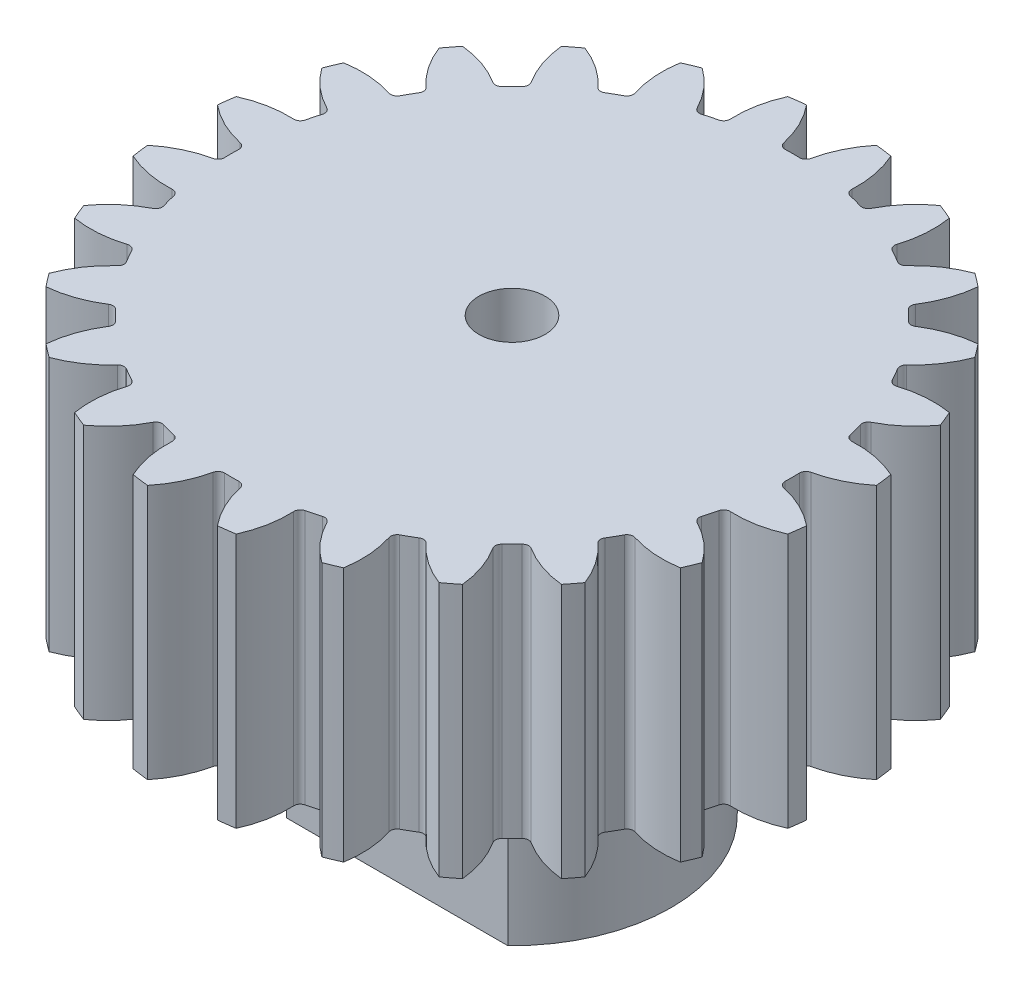
from build123d import *

# Parameters (mm, degrees)
SKETCH_1_R               = 26
EXTRUDE_1_DEPTH          = 20
SKETCH_2_R               = 12.5
EXTRUDE_2_DEPTH          = 14
CUT_EXTRUDE_1_REACH      = 43.857
PATTERN_CIRCULAR_1_COUNT = 24
CUT_EXTRUDE_4_DEPTH      = 42.676911108
CUT_EXTRUDE_4_DEPTH_BACK = 42.676911108
SKETCH_7_R               = 2.15
CUT_EXTRUDE_2_DEPTH      = 42.676911108
CUT_EXTRUDE_2_DEPTH_BACK = 42.676911108
SKETCH_5_R               = 2.6
CUT_EXTRUDE_START        = -12.5
SKETCH_8_W               = 25
SKETCH_8_H               = 14
CUT_EXTRUDE_5_DEPTH      = 3.5
CUT_EXTRUDE_START_2      = 12.5
SKETCH_8_2_W             = 25
SKETCH_8_2_H             = 14
CUT_EXTRUDE_6_DEPTH      = 3.5


with BuildPart() as part:
    # 草图1 → 凸台-拉伸1 (new body)
    with BuildSketch(Plane(origin=(0, 0, 0), x_dir=(1, 0, 0), z_dir=(0, 1, 0))):
        Circle(SKETCH_1_R)
    extrude(amount=EXTRUDE_1_DEPTH)

    # 草图2 → 凸台-拉伸2 (add)
    with BuildSketch(Plane(origin=(0, 0, 0), x_dir=(1, 0, 0), z_dir=(0, 1, 0))):
        Circle(SKETCH_2_R)
    extrude(amount=-EXTRUDE_2_DEPTH)

    # 草图4 → 切除-拉伸1 (cut, up to next)
    with BuildSketch(Plane(origin=(0, 0, 0), x_dir=(1, 0, 0), z_dir=(0, 1, 0)), mode=Mode.PRIVATE) as cut_extrude_1_sk1:
        with BuildLine():
            ThreePointArc((2.741813312, 25.855027746), (1.695394394, 24.220742425), (1.06187474, 22.386475838))
            ThreePointArc((1.06187474, 22.386475838), (0.882061796, 22.099428872), (0.560547841, 21.992857616))
            ThreePointArc((0.560547841, 21.992857616), (0, 22), (-0.560547841, 21.992857616))
            ThreePointArc((-0.560547841, 21.992857616), (-0.882061796, 22.099428872), (-1.06187474, 22.386475838))
            ThreePointArc((-1.06187474, 22.386475838), (-1.695394394, 24.220742425), (-2.741813312, 25.855027746))
            ThreePointArc((-2.741813312, 25.855027746), (0, 26), (2.741813312, 25.855027746))
        make_face()
    cut_extrude_1_tool1 = extrude(cut_extrude_1_sk1.sketch, amount=CUT_EXTRUDE_1_REACH, mode=Mode.PRIVATE) & part.part
    cut_extrude_1 = cut_extrude_1_tool1.solids().sort_by_distance((0, 0, -24.336645))[0]
    add(cut_extrude_1, mode=Mode.SUBTRACT)

    # 阵列(圆周)1: 切除-拉伸1 ×24 about axis
    pattern_circular_1_axis = Axis((0, 20, 0), (0, 1, 0))
    for i in range(1, PATTERN_CIRCULAR_1_COUNT):
        add(cut_extrude_1.rotate(pattern_circular_1_axis, i * 360 / PATTERN_CIRCULAR_1_COUNT), mode=Mode.SUBTRACT)

    # 草图7 → 切除-拉伸4 (cut, two sides: drawn at the far end of the back side and taken through both)
    with BuildSketch(Plane.XY.offset(-CUT_EXTRUDE_4_DEPTH_BACK)):
        with Locations((-4, -7)):
            Circle(SKETCH_7_R)
        with Locations((4.5, -7)):
            Circle(SKETCH_7_R)
    extrude(amount=CUT_EXTRUDE_4_DEPTH + CUT_EXTRUDE_4_DEPTH_BACK, mode=Mode.SUBTRACT)

    # 草图5 → 切除-拉伸2 (cut, two sides: drawn at the far end of the back side and taken through both)
    with BuildSketch(Plane(origin=(0, 0, 0), x_dir=(1, 0, 0), z_dir=(0, 1, 0)).offset(-CUT_EXTRUDE_2_DEPTH_BACK)):
        Circle(SKETCH_5_R)
    extrude(amount=CUT_EXTRUDE_2_DEPTH + CUT_EXTRUDE_2_DEPTH_BACK, mode=Mode.SUBTRACT)

    # 草图8 → 切除-拉伸5 (cut)
    with BuildSketch(Plane.XY.offset(CUT_EXTRUDE_START)):
        with Locations((0, -7)):
            Rectangle(SKETCH_8_W, SKETCH_8_H)
    extrude(amount=CUT_EXTRUDE_5_DEPTH, mode=Mode.SUBTRACT)

    # 草图8<2> → 切除-拉伸6 (cut)
    with BuildSketch(Plane.XY.offset(CUT_EXTRUDE_START_2)):
        with Locations((0, -7)):
            Rectangle(SKETCH_8_2_W, SKETCH_8_2_H)
    extrude(amount=-CUT_EXTRUDE_6_DEPTH, mode=Mode.SUBTRACT)


solid = part.part
